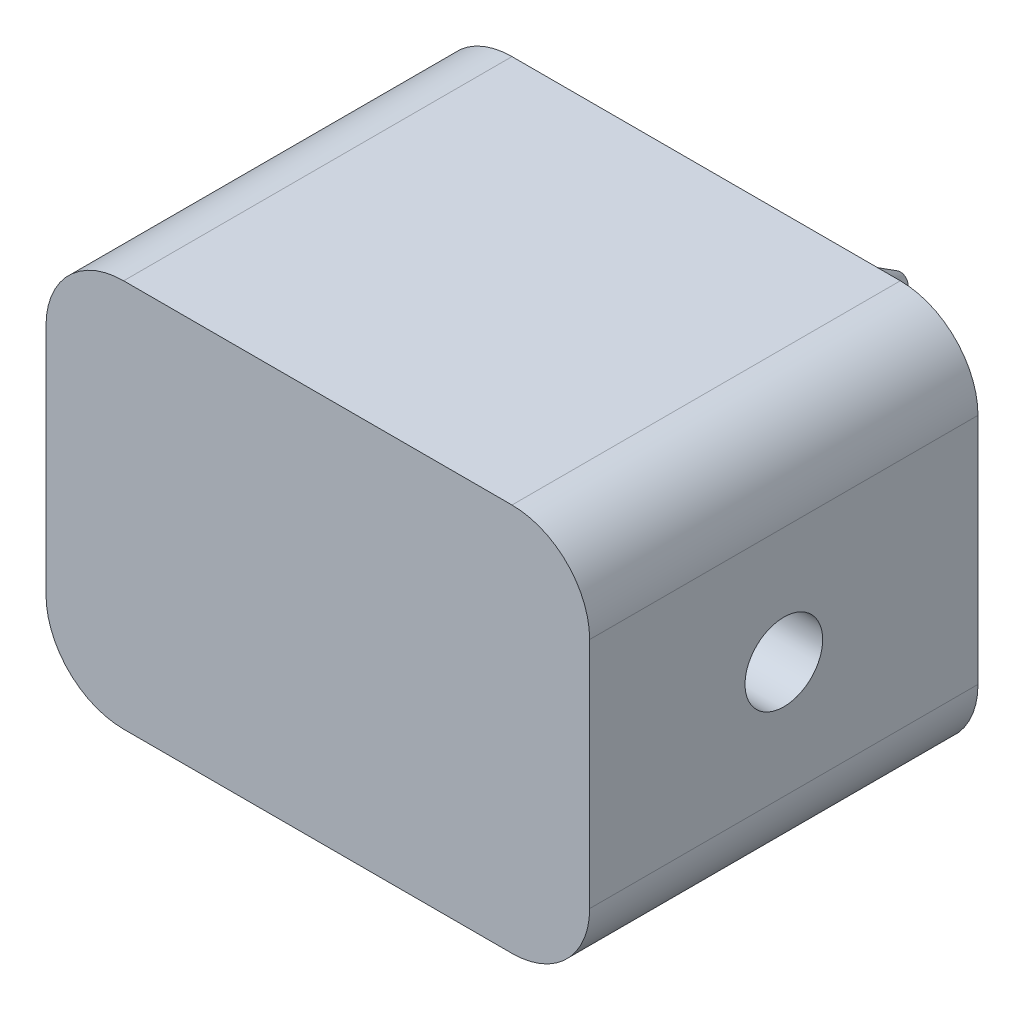
from build123d import *

# Parameters (mm, degrees)
SKETCH1_W           = 70
SKETCH1_H           = 50
BOSS_EXTRUDE1_DEPTH = 50
SKETCH2_R           = 5
CUT_EXTRUDE1_DEPTH  = 100.498743711
SKETCH3_R           = 15
BOSS_EXTRUDE2_DEPTH = 10
FILLET1_R           = 3
FILLET2_R           = 10


with BuildPart() as part:
    # Sketch1 → Boss-Extrude1 (new body)
    with BuildSketch(Plane.XY):
        with Locations((35, 25)):
            Rectangle(SKETCH1_W, SKETCH1_H)
    extrude(amount=BOSS_EXTRUDE1_DEPTH)

    # Sketch2 → Cut-Extrude1 (cut, through all)
    with BuildSketch(Plane(origin=(70, 0, 0), x_dir=(0, 0, -1), z_dir=(1, 0, 0))):
        with Locations((-25, 25)):
            Circle(SKETCH2_R)
    extrude(amount=-CUT_EXTRUDE1_DEPTH, mode=Mode.SUBTRACT)

    # Sketch3 → Boss-Extrude2 (add)
    with BuildSketch(Plane(origin=(0, 0, 0), x_dir=(-1, 0, 0), z_dir=(0, 0, -1))):
        with Locations((-35, 25)):
            Circle(SKETCH3_R)
    extrude(amount=BOSS_EXTRUDE2_DEPTH)

    # Sketch4 → Revolve1 (revolve)
    with BuildSketch(Plane(origin=(35, 0, 0), x_dir=(0, 0, -1), z_dir=(1, 0, 0)), mode=Mode.PRIVATE) as revolve1_sk:
        Polygon((10, 25), (10, 35), (25, 26), (25, 25), align=None)
    revolve(revolve1_sk.sketch.rotate(Axis((35, 25, -10), (0, 0, -1)), 90), axis=Axis((35, 25, -10), (0, 0, -1)))

    # Fillet1
    fillet1_edges = [part.edges().sort_by_distance(p)[0] for p in [
        (50, 25, -10),
    ]]
    fillet(fillet1_edges, radius=FILLET1_R)

    # Fillet2
    fillet2_edges = [part.edges().sort_by_distance(p)[0] for p in [
        (0, 50, 25),
        (70, 50, 25),
        (70, 0, 25),
        (0, 0, 25),
    ]]
    fillet(fillet2_edges, radius=FILLET2_R)


solid = part.part
